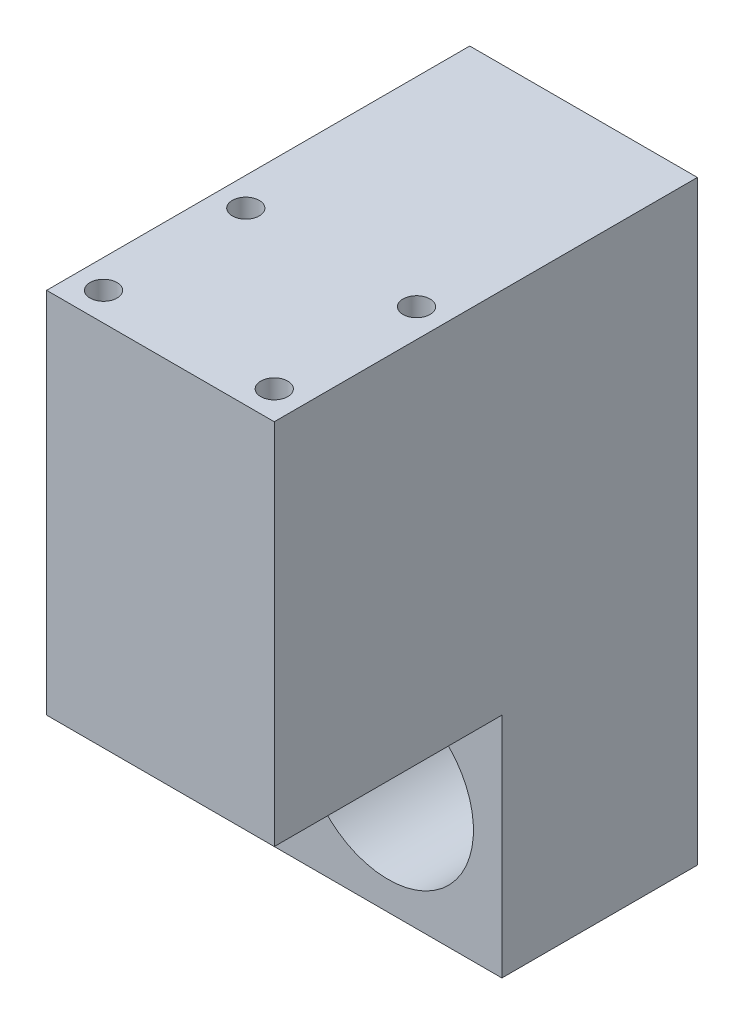
from build123d import *

# Parameters (mm, degrees)
SKETCH1_W                = 8
SKETCH1_H                = 6.87
BOSS_EXTRUDE3_DEPTH      = 8
SKETCH2_W                = 8
SKETCH2_H                = 14.87
BOSS_EXTRUDE5_DEPTH      = 12.93
M1_2X0_25_TAPPED_HOLE1_D = 0.95
F_1_0MM_DOWEL_HOLE1_D    = 6


with BuildPart() as part:
    # Sketch1 → Boss-Extrude3 (new body)
    with BuildSketch(Plane(origin=(0, 0, 0), x_dir=(1, 0, 0), z_dir=(0, 1, 0))):
        with Locations((-14.308724832, -6.420704698)):
            Rectangle(SKETCH1_W, SKETCH1_H)
    extrude(amount=BOSS_EXTRUDE3_DEPTH)

    # Sketch2 → Boss-Extrude5 (add)
    with BuildSketch(Plane(origin=(0, 8, 0), x_dir=(1, 0, 0), z_dir=(0, 1, 0))):
        with Locations((-14.308724832, -10.420704698)):
            Rectangle(SKETCH2_W, SKETCH2_H)
    extrude(amount=BOSS_EXTRUDE5_DEPTH)

    # M1.2x0.25 Tapped Hole1 (through all)
    with Locations(Plane(origin=(0, 20.93, 0), x_dir=(1, 0, 0), z_dir=(0, 1, 0))):
        with Locations((-17.308724832, -11.855704698), (-11.308724832, -11.855704698), (-17.308724832, -16.855704698), (-11.308724832, -16.855704698)):
            Hole(M1_2X0_25_TAPPED_HOLE1_D / 2)

    # Ø1.0mm Dowel Hole1 (through all)
    with Locations(Plane(origin=(0, 0, 2.985704698), x_dir=(-1, 0, 0), z_dir=(0, 0, -1))):
        with Locations((14.308724832, 4)):
            Hole(F_1_0MM_DOWEL_HOLE1_D / 2)


solid = part.part
